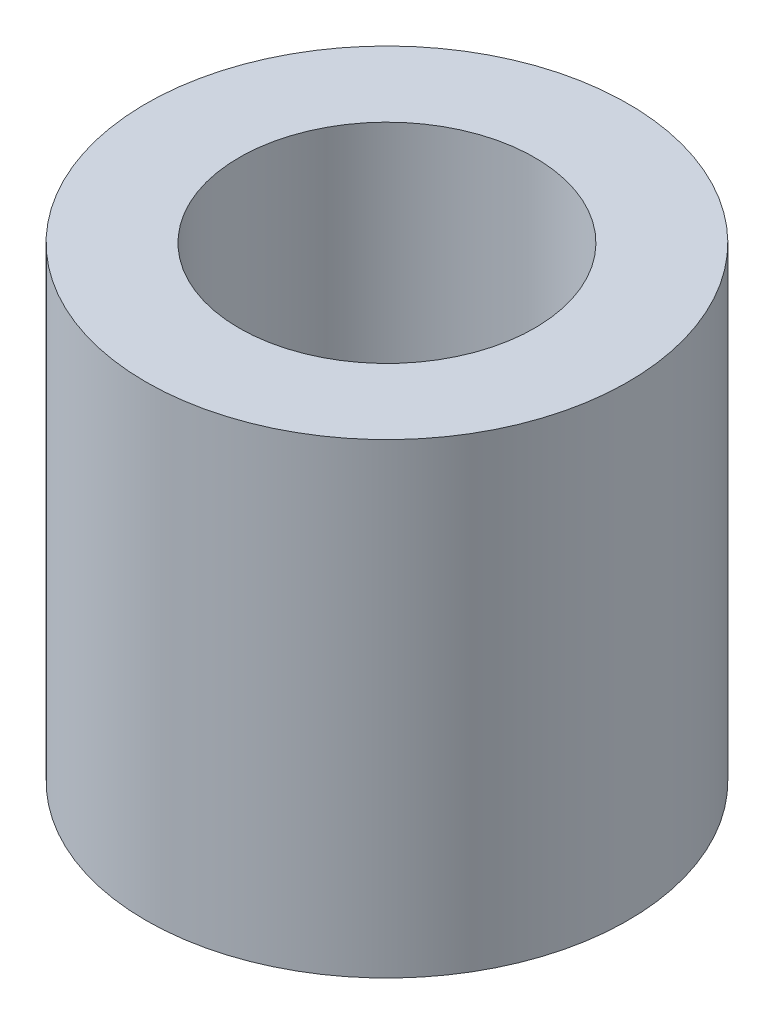
from build123d import *

# Parameters (mm, degrees)
SKETCH1_R           = 6.565
SKETCH1_R_2         = 4.025
BOSS_EXTRUDE1_DEPTH = 12.7


with BuildPart() as part:
    # Sketch1 → Boss-Extrude1 (new body)
    with BuildSketch(Plane(origin=(0, 0, 0), x_dir=(1, 0, 0), z_dir=(0, 1, 0))):
        with Locations(Location((0, 0, 0), (0, 0, 270))):
            Circle(SKETCH1_R)
        with Locations(Location((0, 0, 0), (0, 0, 270))):
            Circle(SKETCH1_R_2, mode=Mode.SUBTRACT)
    extrude(amount=BOSS_EXTRUDE1_DEPTH)


solid = part.part
